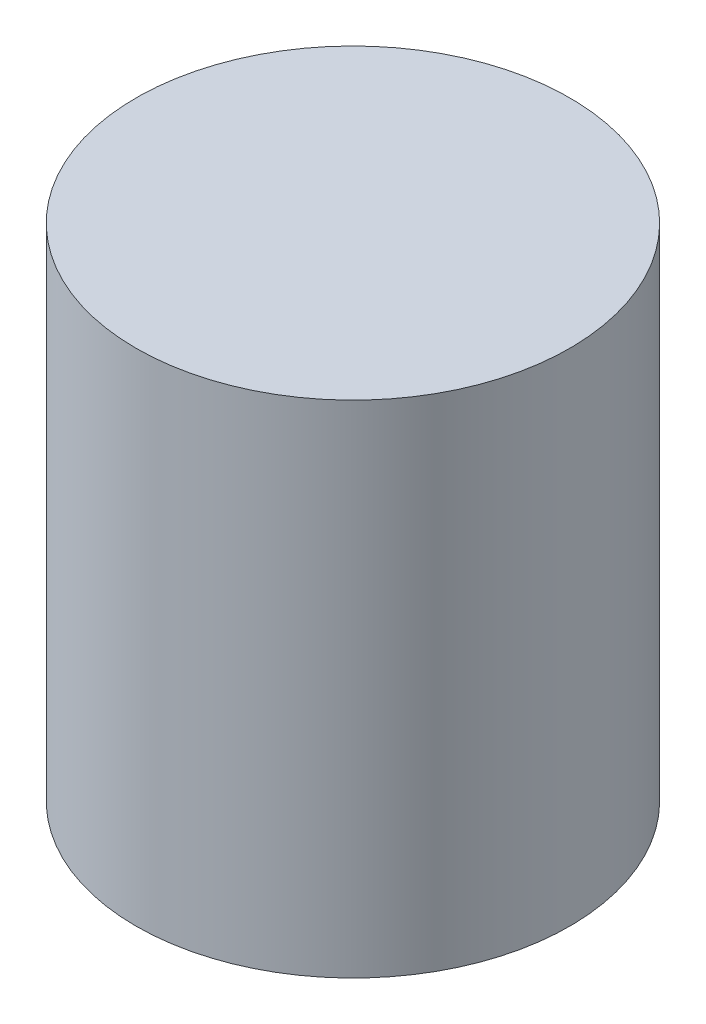
from build123d import *

# Parameters (mm, degrees)
SKETCH1_W          = 6.5
SKETCH1_H          = 15
SKETCH2_R          = 4.5
CUT_EXTRUDE1_DEPTH = 13
SKETCH3_R          = 2
CUT_EXTRUDE2_DEPTH = 13


with BuildPart() as part:
    # Sketch1 → Revolve1 (revolve)
    with BuildSketch(Plane.XY, mode=Mode.PRIVATE) as revolve1_sk:
        with Locations((3.25, 0)):
            Rectangle(SKETCH1_W, SKETCH1_H)
    revolve(revolve1_sk.sketch.rotate(Axis((0, 7.5, 0), (0, -1, 0)), 90), axis=Axis((0, 7.5, 0), (0, -1, 0)))

    # Sketch2 → Cut-Extrude1 (cut)
    with BuildSketch(Plane.XZ.offset(7.5)):
        with Locations(Location((0, 0, 0), (0, 0, 270))):
            Circle(SKETCH2_R)
    extrude(amount=-CUT_EXTRUDE1_DEPTH, mode=Mode.SUBTRACT)

    # Sketch3 → Cut-Extrude2 (cut)
    with BuildSketch(Plane.XY):
        Circle(SKETCH3_R)
    extrude(amount=-CUT_EXTRUDE2_DEPTH, mode=Mode.SUBTRACT)


solid = part.part
